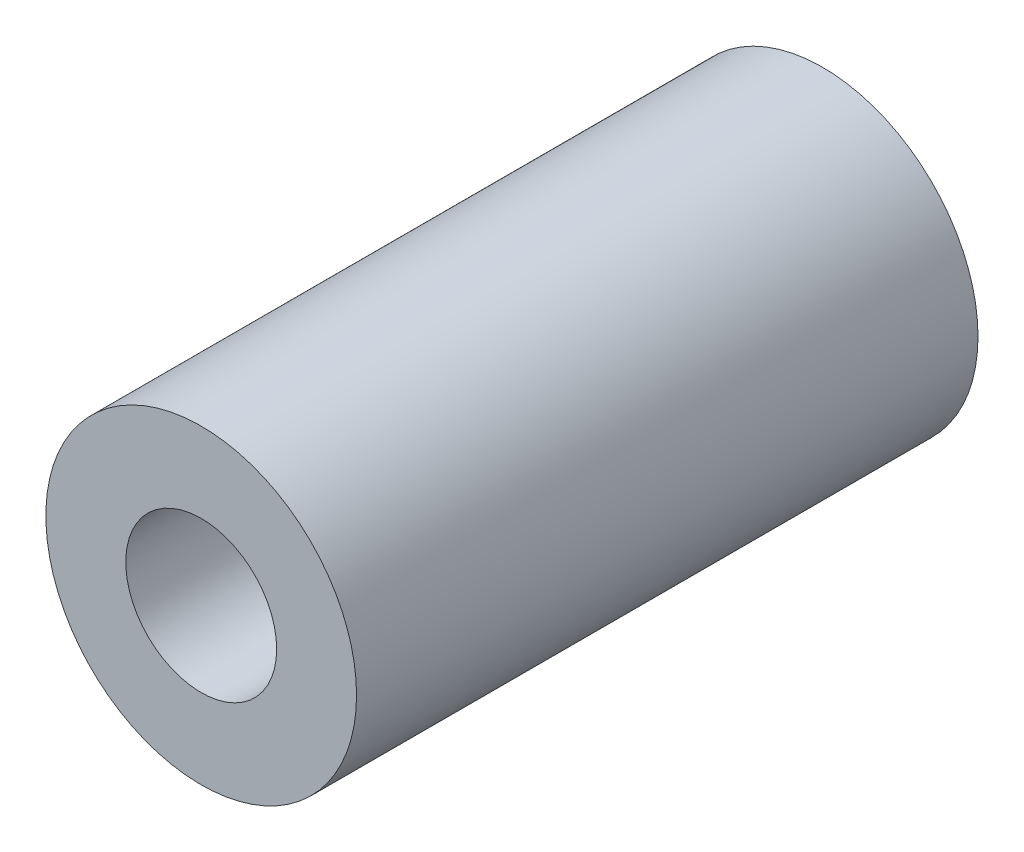
from build123d import *

# Parameters (mm, degrees)
ESBO_O1_R                = 3.5
ESBO_O1_R_2              = 1.7
RESSALTO_EXTRUS_O1_DEPTH = 14


with BuildPart() as part:
    # Esboço1 → Ressalto-extrusão1 (new body)
    with BuildSketch(Plane.XY):
        Circle(ESBO_O1_R)
        Circle(ESBO_O1_R_2, mode=Mode.SUBTRACT)
    extrude(amount=RESSALTO_EXTRUS_O1_DEPTH)


solid = part.part
